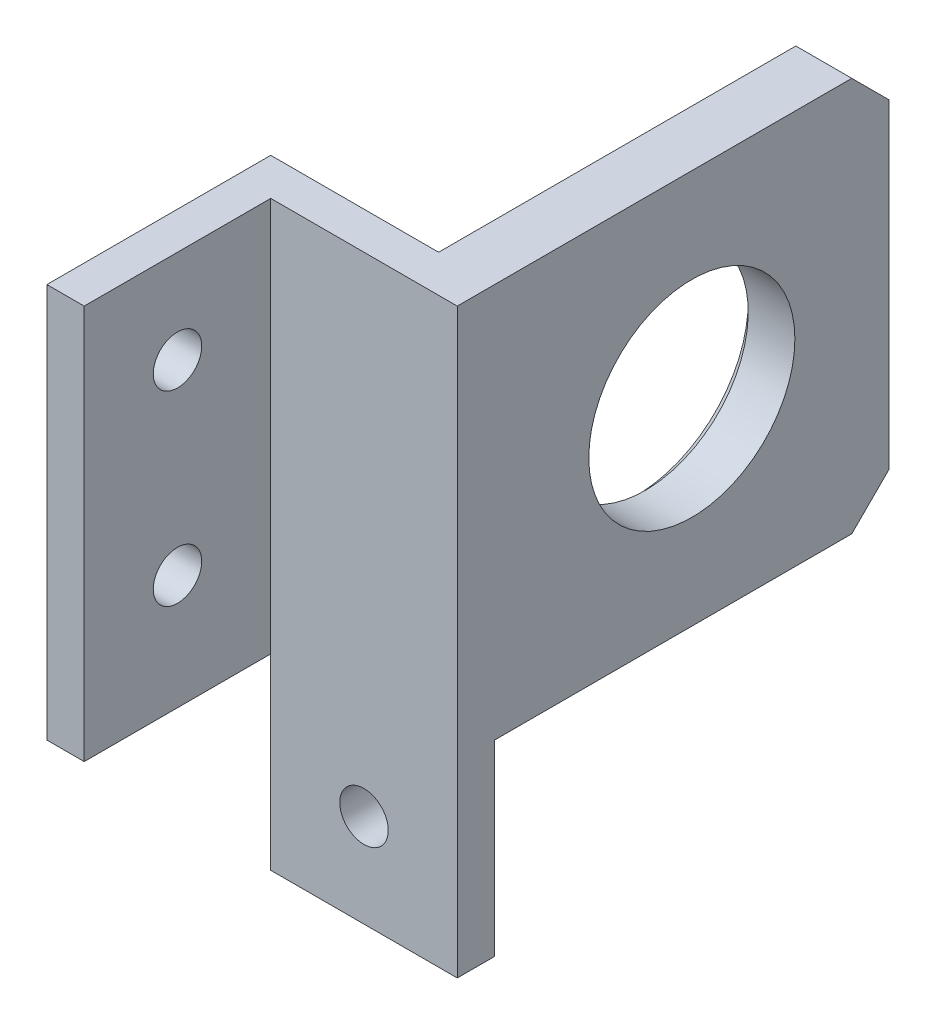
from build123d import *

# Parameters (mm, degrees)
SKICA2_W                 = 20
SKICA2_H                 = 42.3
P_IDAT_VYSUNUT_M1_DEPTH  = 4
SKICA3_W                 = 24
SKICA3_H                 = 42.3
P_IDAT_VYSUNUT_M2_DEPTH  = 4
SKICA4_W                 = 6
SKICA4_H                 = 42.3
P_IDAT_VYSUNUT_M3_DEPTH  = 42.3
SKICA5_R                 = 11.05
ODEBRAT_VYSUNUT_M1_DEPTH = 7
SKICA7_R                 = 2.6
ODEBRAT_VYSUNUT_M3_DEPTH = 4
ZKOSEN_1_SIZE            = 1
SKICA8_W                 = 20
SKICA8_H                 = 4
P_IDAT_VYSUNUT_M4_DEPTH  = 20.091596743
SKICA9_R                 = 2.6
ODEBRAT_VYSUNUT_M4_DEPTH = 4
ODEBRAT_VYSUNUT_M5_DEPTH = 80
SKICA11_W                = 84.692176523
SKICA11_H                = 80.474242756
ODEBRAT_VYSUNUT_M6_DEPTH = 24


with BuildPart() as part:
    # Skica2 → Přidat vysunutím1 (new body)
    with BuildSketch(Plane.XY):
        with Locations((-14.524287798, -61.15)):
            Rectangle(SKICA2_W, SKICA2_H)
    extrude(amount=P_IDAT_VYSUNUT_M1_DEPTH)

    # Skica3 → Přidat vysunutím2 (add)
    with BuildSketch(Plane.ZY.offset(24.524287798)):
        with Locations((-8, -61.15)):
            Rectangle(SKICA3_W, SKICA3_H)
    extrude(amount=P_IDAT_VYSUNUT_M2_DEPTH)

    # Skica4 → Přidat vysunutím3 (add)
    with BuildSketch(Plane.XY.offset(4)):
        with Locations((-7.524287798, -61.15)):
            Rectangle(SKICA4_W, SKICA4_H)
    extrude(amount=P_IDAT_VYSUNUT_M3_DEPTH)

    # Skica5 → Odebrat vysunutím1 (cut)
    with BuildSketch(Plane(origin=(-4.524287798, 0, 0), x_dir=(0, 0, -1), z_dir=(1, 0, 0))):
        with Locations((-25.15, -61.15)):
            Circle(SKICA5_R)
    extrude(amount=-ODEBRAT_VYSUNUT_M1_DEPTH, mode=Mode.SUBTRACT)

    # Skica7 → Odebrat vysunutím3 (cut)
    with BuildSketch(Plane.ZY.offset(28.524287798)):
        with Locations(Location((-10, -50, 0), (0, 0, 270))):
            Circle(SKICA7_R)
        with Locations(Location((-10, -70, 0), (0, 0, 270))):
            Circle(SKICA7_R)
    extrude(amount=-ODEBRAT_VYSUNUT_M3_DEPTH, mode=Mode.SUBTRACT)

    # Zkosení1
    zkosen_1_edges = [part.edges().sort_by_distance(p)[0] for p in [
        (-10.524287798, -61.15, 36.2),
    ]]
    chamfer(zkosen_1_edges, length=ZKOSEN_1_SIZE)

    # Skica8 → Přidat vysunutím4 (add)
    with BuildSketch(Plane.XZ.offset(82.3)):
        with Locations((-14.524287798, 2)):
            Rectangle(SKICA8_W, SKICA8_H)
    extrude(amount=P_IDAT_VYSUNUT_M4_DEPTH)

    # Skica9 → Odebrat vysunutím4 (cut)
    with BuildSketch(Plane.XY.offset(4)):
        with Locations((-14.524287798, -92.391596743)):
            Circle(SKICA9_R)
    extrude(amount=-ODEBRAT_VYSUNUT_M4_DEPTH, mode=Mode.SUBTRACT)

    # Skica10 → Odebrat vysunutím5 (cut)
    with BuildSketch(Plane.ZY.offset(10.524287798)):
        Polygon((46.3, -44), (42.3, -40), (46.565878614, -39.259270079), align=None)
        Polygon((42.3, -82.3), (46.3, -78.3), (47.745576453, -80.3), (46.3, -85.415433185), align=None)
    extrude(amount=-ODEBRAT_VYSUNUT_M5_DEPTH, mode=Mode.SUBTRACT)


with BuildPart() as body_2:
    # Zrcadlit1: mirrored copy
    add(part.part.mirror(Plane(origin=(-28.524287798, -40, -20), x_dir=(1, 0, 0), z_dir=(0, 0, 1))))


with BuildPart() as part_1:
    add(part.part)

    # Skica11 → Odebrat vysunutím6 (cut)
    with BuildSketch(Plane.ZY.offset(28.524287798)):
        with Locations((22.346088262, -80.237121378)):
            Rectangle(SKICA11_W, SKICA11_H)
    extrude(amount=-ODEBRAT_VYSUNUT_M6_DEPTH, mode=Mode.SUBTRACT)


solid = body_2.part
